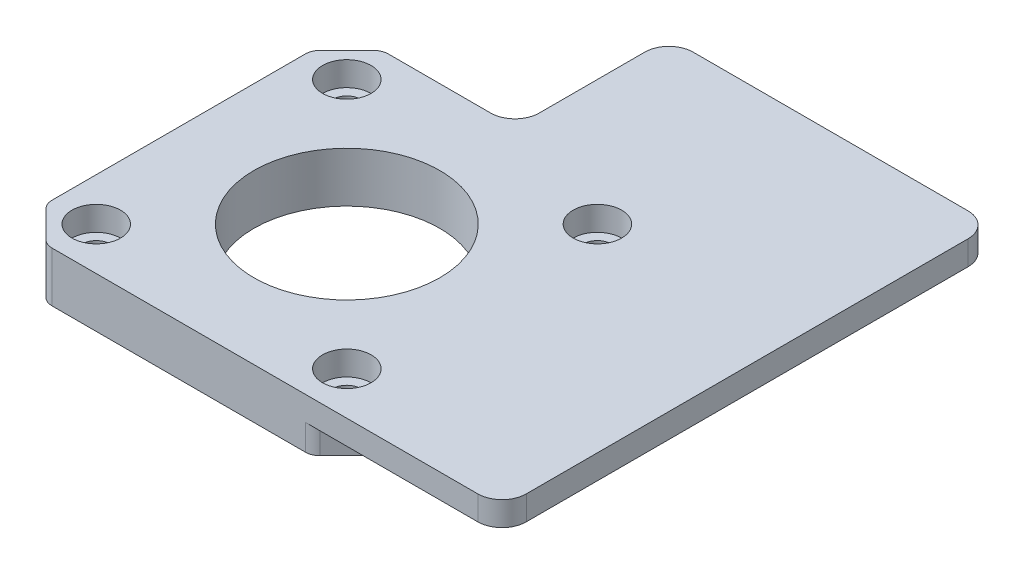
from build123d import *

# Parameters (mm, degrees)
SKETCH1_R           = 1.75
SKETCH1_R_2         = 11.5
BOSS_EXTRUDE1_DEPTH = 3.2
BOSS_EXTRUDE2_START = 3.2
SKETCH1_5_R         = 2.55
SKETCH1_5_R_2       = 3
SKETCH1_5_R_3       = 11.5
SKETCH1_5_R_4       = 1.75
BOSS_EXTRUDE2_DEPTH = 3
BOSS_EXTRUDE3_START = 5
SKETCH1_6_R         = 2.55
BOSS_EXTRUDE3_DEPTH = 1.2
CUT_EXTRUDE2_START  = 3.2
SKETCH1_4_R         = 3
CUT_EXTRUDE2_DEPTH  = 3
FILLET1_R           = 3


with BuildPart() as part:
    # Sketch1 → Boss-Extrude1 (new body)
    with BuildSketch(Plane(origin=(0, -68.726755499, 0), x_dir=(1, 0, 0), z_dir=(0, 1, 0))):
        with BuildLine():
            Line((137.12924475, -27.521572875), (137.12924475, 3.821572875))
            ThreePointArc((137.12924475, 3.821572875), (136.992227909, 4.510403054), (136.602036956, 5.094365081))
            Line((136.602036956, 5.094365081), (133.273609831, 8.422792206))
            ThreePointArc((133.273609831, 8.422792206), (132.689647804, 8.812983159), (132.000817625, 8.95))
            Line((132.000817625, 8.95), (100.657671875, 8.95))
            ThreePointArc((100.657671875, 8.95), (99.968841697, 8.812983159), (99.384879669, 8.422792206))
            Line((99.384879669, 8.422792206), (96.056452544, 5.094365081))
            ThreePointArc((96.056452544, 5.094365081), (95.666261592, 4.510403054), (95.52924475, 3.821572875))
            Line((95.52924475, 3.821572875), (95.52924475, -27.521572875))
            ThreePointArc((95.52924475, -27.521572875), (95.666261592, -28.210403054), (96.056452544, -28.794365081))
            Line((96.056452544, -28.794365081), (99.384879669, -32.122792206))
            ThreePointArc((99.384879669, -32.122792206), (99.968841697, -32.512983159), (100.657671875, -32.65))
            Line((100.657671875, -32.65), (132.000817625, -32.65))
            ThreePointArc((132.000817625, -32.65), (132.689647804, -32.512983159), (133.273609831, -32.122792206))
            Line((133.273609831, -32.122792206), (136.602036956, -28.794365081))
            ThreePointArc((136.602036956, -28.794365081), (136.992227909, -28.210403054), (137.12924475, -27.521572875))
        make_face()
        with Locations((100.82924475, -27.35)):
            Circle(SKETCH1_R, mode=Mode.SUBTRACT)
        with Locations((100.82924475, 3.65)):
            Circle(SKETCH1_R, mode=Mode.SUBTRACT)
        with Locations((131.82924475, 3.65)):
            Circle(SKETCH1_R, mode=Mode.SUBTRACT)
        with Locations((131.82924475, -27.35)):
            Circle(SKETCH1_R, mode=Mode.SUBTRACT)
        with Locations((116.32924475, -11.85)):
            Circle(SKETCH1_R_2, mode=Mode.SUBTRACT)
    extrude(amount=BOSS_EXTRUDE1_DEPTH)

    # Sketch1<5> → Boss-Extrude2 (add)
    # profile 1 of 6: a face of its own
    with BuildSketch(Plane(origin=(0, -68.726755499, 0), x_dir=(1, 0, 0), z_dir=(0, 1, 0)).offset(BOSS_EXTRUDE2_START)):
        with BuildLine():
            ThreePointArc((133.273609831, -32.122792206), (132.689647804, -32.512983159), (132.000817625, -32.65))
            Line((132.000817625, -32.65), (156.32924475, -32.65))
            Line((156.32924475, -32.65), (156.32924475, 28))
            Line((156.32924475, 28), (116.32924475, 28))
            Line((116.32924475, 28), (116.32924475, 8.95))
            Line((116.32924475, 8.95), (132.000817625, 8.95))
            ThreePointArc((132.000817625, 8.95), (132.689647804, 8.812983159), (133.273609831, 8.422792206))
            Line((133.273609831, 8.422792206), (136.602036956, 5.094365081))
            ThreePointArc((136.602036956, 5.094365081), (136.992227909, 4.510403054), (137.12924475, 3.821572875))
            Line((137.12924475, 3.821572875), (137.12924475, -27.521572875))
            ThreePointArc((137.12924475, -27.521572875), (136.992227909, -28.210403054), (136.602036956, -28.794365081))
            Line((136.602036956, -28.794365081), (133.273609831, -32.122792206))
        make_face()
        with Locations((144.32924475, -16)):
            Circle(SKETCH1_5_R, mode=Mode.SUBTRACT)
        with Locations((152.32924475, -16)):
            Circle(SKETCH1_5_R, mode=Mode.SUBTRACT)
        with Locations((144.32924475, -8)):
            Circle(SKETCH1_5_R, mode=Mode.SUBTRACT)
        with Locations((152.32924475, -8)):
            Circle(SKETCH1_5_R, mode=Mode.SUBTRACT)
        with Locations((120.32924475, 16)):
            Circle(SKETCH1_5_R, mode=Mode.SUBTRACT)
        with Locations((120.32924475, 24)):
            Circle(SKETCH1_5_R, mode=Mode.SUBTRACT)
        with Locations((144.32924475, 0)):
            Circle(SKETCH1_5_R, mode=Mode.SUBTRACT)
        with Locations((152.32924475, 0)):
            Circle(SKETCH1_5_R, mode=Mode.SUBTRACT)
        with Locations((144.32924475, 8)):
            Circle(SKETCH1_5_R, mode=Mode.SUBTRACT)
        with Locations((152.32924475, 8)):
            Circle(SKETCH1_5_R, mode=Mode.SUBTRACT)
        with Locations((128.32924475, 16)):
            Circle(SKETCH1_5_R, mode=Mode.SUBTRACT)
        with Locations((136.32924475, 16)):
            Circle(SKETCH1_5_R, mode=Mode.SUBTRACT)
        with Locations((128.32924475, 24)):
            Circle(SKETCH1_5_R, mode=Mode.SUBTRACT)
        with Locations((136.32924475, 24)):
            Circle(SKETCH1_5_R, mode=Mode.SUBTRACT)
        with Locations((144.32924475, 16)):
            Circle(SKETCH1_5_R, mode=Mode.SUBTRACT)
        with Locations((152.32924475, 16)):
            Circle(SKETCH1_5_R, mode=Mode.SUBTRACT)
        with Locations((144.32924475, 24)):
            Circle(SKETCH1_5_R, mode=Mode.SUBTRACT)
        with Locations((152.32924475, 24)):
            Circle(SKETCH1_5_R, mode=Mode.SUBTRACT)
    # profile 2 of 6: a face of its own
    with BuildSketch(Plane(origin=(0, -68.726755499, 0), x_dir=(1, 0, 0), z_dir=(0, 1, 0)).offset(BOSS_EXTRUDE2_START)):
        with BuildLine():
            Line((100.657671875, -32.65), (132.000817625, -32.65))
            ThreePointArc((132.000817625, -32.65), (132.689647804, -32.512983159), (133.273609831, -32.122792206))
            Line((133.273609831, -32.122792206), (136.602036956, -28.794365081))
            ThreePointArc((136.602036956, -28.794365081), (136.992227909, -28.210403054), (137.12924475, -27.521572875))
            Line((137.12924475, -27.521572875), (137.12924475, 3.821572875))
            ThreePointArc((137.12924475, 3.821572875), (136.992227909, 4.510403054), (136.602036956, 5.094365081))
            Line((136.602036956, 5.094365081), (133.273609831, 8.422792206))
            ThreePointArc((133.273609831, 8.422792206), (132.689647804, 8.812983159), (132.000817625, 8.95))
            Line((132.000817625, 8.95), (116.32924475, 8.95))
            Line((116.32924475, 8.95), (100.657671875, 8.95))
            ThreePointArc((100.657671875, 8.95), (99.968841697, 8.812983159), (99.384879669, 8.422792206))
            Line((99.384879669, 8.422792206), (96.056452544, 5.094365081))
            ThreePointArc((96.056452544, 5.094365081), (95.666261592, 4.510403054), (95.52924475, 3.821572875))
            Line((95.52924475, 3.821572875), (95.52924475, -27.521572875))
            ThreePointArc((95.52924475, -27.521572875), (95.666261592, -28.210403054), (96.056452544, -28.794365081))
            Line((96.056452544, -28.794365081), (99.384879669, -32.122792206))
            ThreePointArc((99.384879669, -32.122792206), (99.968841697, -32.512983159), (100.657671875, -32.65))
        make_face()
        with Locations((100.82924475, -27.35)):
            Circle(SKETCH1_5_R_2, mode=Mode.SUBTRACT)
        with Locations((116.32924475, -11.85)):
            Circle(SKETCH1_5_R_3, mode=Mode.SUBTRACT)
        with Locations((131.82924475, -27.35)):
            Circle(SKETCH1_5_R_2, mode=Mode.SUBTRACT)
        with Locations((100.82924475, 3.65)):
            Circle(SKETCH1_5_R_2, mode=Mode.SUBTRACT)
        with Locations((131.82924475, 3.65)):
            Circle(SKETCH1_5_R_2, mode=Mode.SUBTRACT)
    # profile 3 of 6: a face of its own
    with BuildSketch(Plane(origin=(0, -68.726755499, 0), x_dir=(1, 0, 0), z_dir=(0, 1, 0)).offset(BOSS_EXTRUDE2_START)):
        with Locations((131.82924475, 3.65)):
            Circle(SKETCH1_5_R_2)
        with Locations((131.82924475, 3.65)):
            Circle(SKETCH1_5_R_4, mode=Mode.SUBTRACT)
    # profile 4 of 6: a face of its own
    with BuildSketch(Plane(origin=(0, -68.726755499, 0), x_dir=(1, 0, 0), z_dir=(0, 1, 0)).offset(BOSS_EXTRUDE2_START)):
        with Locations((131.82924475, -27.35)):
            Circle(SKETCH1_5_R_2)
        with Locations((131.82924475, -27.35)):
            Circle(SKETCH1_5_R_4, mode=Mode.SUBTRACT)
    # profile 5 of 6: a face of its own
    with BuildSketch(Plane(origin=(0, -68.726755499, 0), x_dir=(1, 0, 0), z_dir=(0, 1, 0)).offset(BOSS_EXTRUDE2_START)):
        with Locations((100.82924475, 3.65)):
            Circle(SKETCH1_5_R_2)
        with Locations((100.82924475, 3.65)):
            Circle(SKETCH1_5_R_4, mode=Mode.SUBTRACT)
    # profile 6 of 6: a face of its own
    with BuildSketch(Plane(origin=(0, -68.726755499, 0), x_dir=(1, 0, 0), z_dir=(0, 1, 0)).offset(BOSS_EXTRUDE2_START)):
        with Locations((100.82924475, -27.35)):
            Circle(SKETCH1_5_R_2)
        with Locations((100.82924475, -27.35)):
            Circle(SKETCH1_5_R_4, mode=Mode.SUBTRACT)
    extrude(amount=BOSS_EXTRUDE2_DEPTH)

    # Sketch1<6> → Boss-Extrude3 (add)
    with BuildSketch(Plane(origin=(0, -68.726755499, 0), x_dir=(1, 0, 0), z_dir=(0, 1, 0)).offset(BOSS_EXTRUDE3_START)):
        with Locations((152.32924475, -16)):
            Circle(SKETCH1_6_R)
        with Locations((144.32924475, -16)):
            Circle(SKETCH1_6_R)
        with Locations((144.32924475, -8)):
            Circle(SKETCH1_6_R)
        with Locations((152.32924475, -8)):
            Circle(SKETCH1_6_R)
        with Locations((152.32924475, 0)):
            Circle(SKETCH1_6_R)
        with Locations((144.32924475, 0)):
            Circle(SKETCH1_6_R)
        with Locations((152.32924475, 8)):
            Circle(SKETCH1_6_R)
        with Locations((152.32924475, 16)):
            Circle(SKETCH1_6_R)
        with Locations((144.32924475, 24)):
            Circle(SKETCH1_6_R)
        with Locations((152.32924475, 24)):
            Circle(SKETCH1_6_R)
        with Locations((136.32924475, 24)):
            Circle(SKETCH1_6_R)
        with Locations((136.32924475, 16)):
            Circle(SKETCH1_6_R)
        with Locations((128.32924475, 16)):
            Circle(SKETCH1_6_R)
        with Locations((128.32924475, 24)):
            Circle(SKETCH1_6_R)
        with Locations((120.32924475, 16)):
            Circle(SKETCH1_6_R)
        with Locations((120.32924475, 24)):
            Circle(SKETCH1_6_R)
        with Locations((144.32924475, 8)):
            Circle(SKETCH1_6_R)
        with Locations((144.32924475, 16)):
            Circle(SKETCH1_6_R)
    extrude(amount=BOSS_EXTRUDE3_DEPTH)

    # Sketch1<4> → Cut-Extrude2 (cut)
    with BuildSketch(Plane(origin=(0, -68.726755499, 0), x_dir=(1, 0, 0), z_dir=(0, 1, 0)).offset(CUT_EXTRUDE2_START)):
        with Locations((100.82924475, -27.35)):
            Circle(SKETCH1_4_R)
        with Locations((100.82924475, 3.65)):
            Circle(SKETCH1_4_R)
        with Locations((131.82924475, 3.65)):
            Circle(SKETCH1_4_R)
        with Locations((131.82924475, -27.35)):
            Circle(SKETCH1_4_R)
    extrude(amount=CUT_EXTRUDE2_DEPTH, mode=Mode.SUBTRACT)

    # Fillet1
    fillet1_edges = [part.edges().sort_by_distance(p)[0] for p in [
        (156.32924475, -64.026755499, 32.65),
        (156.32924475, -64.026755499, -28),
        (116.32924475, -64.026755499, -28),
        (116.32924475, -64.026755499, -8.95),
    ]]
    fillet(fillet1_edges, radius=FILLET1_R)


solid = part.part
